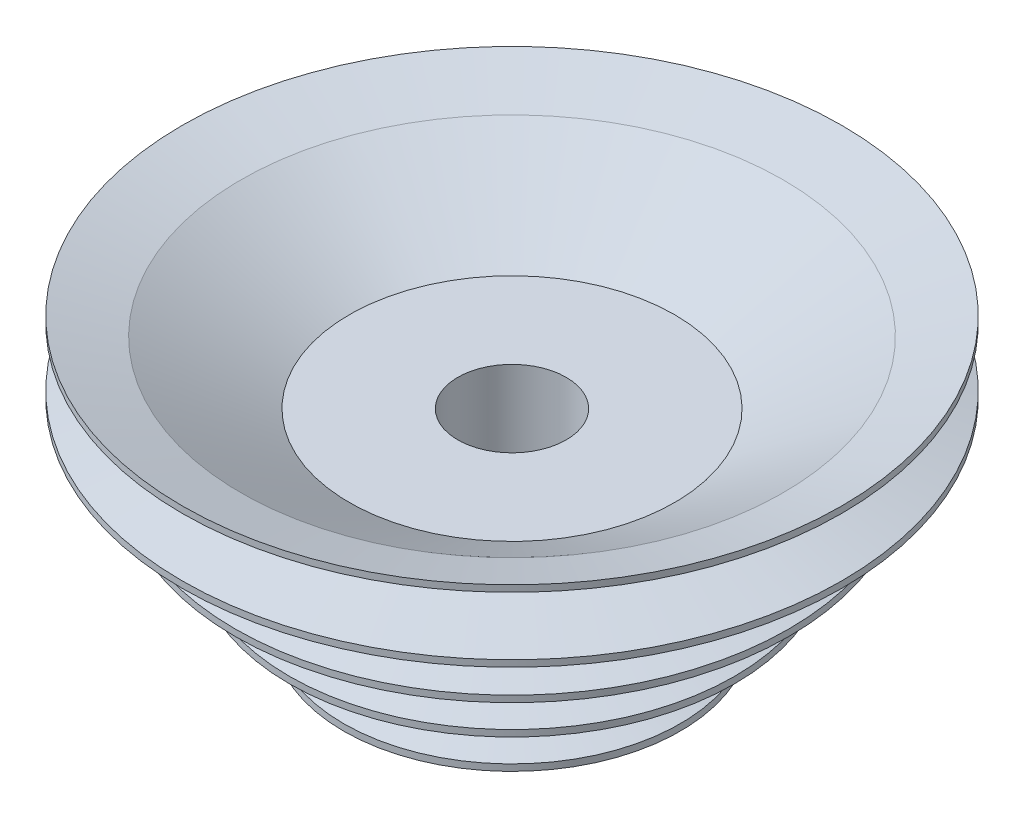
from build123d import *


with BuildPart() as part:
    # Sketch1 → Revolve1 (revolve)
    with BuildSketch(Plane.XY, mode=Mode.PRIVATE) as revolve1_sk:
        Polygon((37.5, 45), (62.5, 59.43375673), (76, 63.561120929), (76, 62.061120929), (62.5, 57.93375673), (62.5, 52.7273642), (76, 48.6), (76, 47.1), (63.8, 47.1), (63.8, 45.6), (50, 41.380916596), (50, 37.119083404), (63.8, 32.9), (63.8, 31.4), (51.3, 31.4), (51.3, 29.9), (37.5, 25.680916596), (37.5, 21.419083404), (51.3, 17.2), (51.3, 15.7), (38.8, 15.7), (38.8, 14.2), (25, 9.980916596), (25, 5.719083404), (38.8, 1.5), (38.8, 0), (12.5, 0), (12.5, 45), align=None)
    revolve(revolve1_sk.sketch.rotate(Axis((0, 0, 0), (0, 1, 0)), 90), axis=Axis((0, 0, 0), (0, 1, 0)))


solid = part.part
